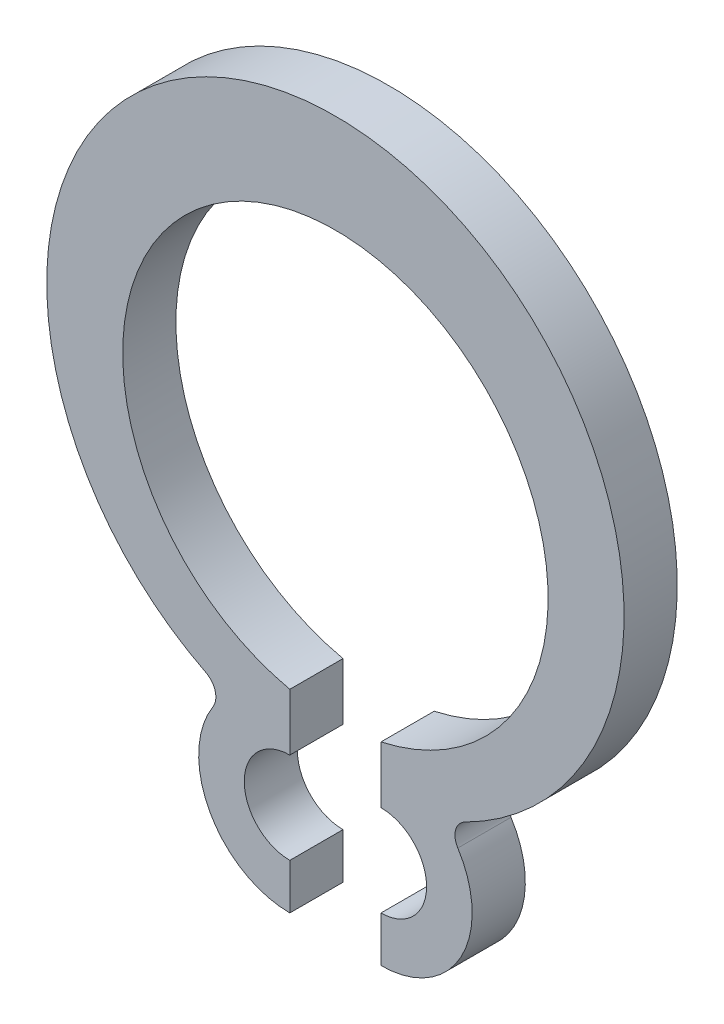
from build123d import *

# Parameters (mm, degrees)
EXTRUDE_1_DEPTH = 0.7


with BuildPart() as part:
    # Sketch 288 → 拉伸1 (new body)
    with BuildSketch(Plane.XY):
        with BuildLine():
            Line((-0.6, -2.734958866), (-0.6, -3.484958866))
            ThreePointArc((-0.6, -3.484958866), (-1.2, -4.084958866), (-0.6, -4.684958866))
            Line((-0.6, -4.684958866), (-0.6, -5.284958866))
            ThreePointArc((-0.6, -5.284958866), (-1.652367602, -4.661606446), (-1.611408717, -3.439162917))
            ThreePointArc((-1.611408717, -3.439162917), (-1.582288686, -3.246338831), (-1.705946473, -3.095548061))
            ThreePointArc((-1.705946473, -3.095548061), (0, 4.1), (1.705946473, -3.095548061))
            ThreePointArc((1.705946473, -3.095548061), (1.582288686, -3.246338831), (1.611408717, -3.439162917))
            ThreePointArc((1.611408717, -3.439162917), (1.652367602, -4.661606446), (0.6, -5.284958866))
            Line((0.6, -5.284958866), (0.6, -4.684958866))
            ThreePointArc((0.6, -4.684958866), (1.2, -4.084958866), (0.6, -3.484958866))
            Line((0.6, -3.484958866), (0.6, -2.734958866))
            ThreePointArc((0.6, -2.734958866), (0, 2.8), (-0.6, -2.734958866))
        make_face()
    extrude(amount=EXTRUDE_1_DEPTH)


solid = part.part
